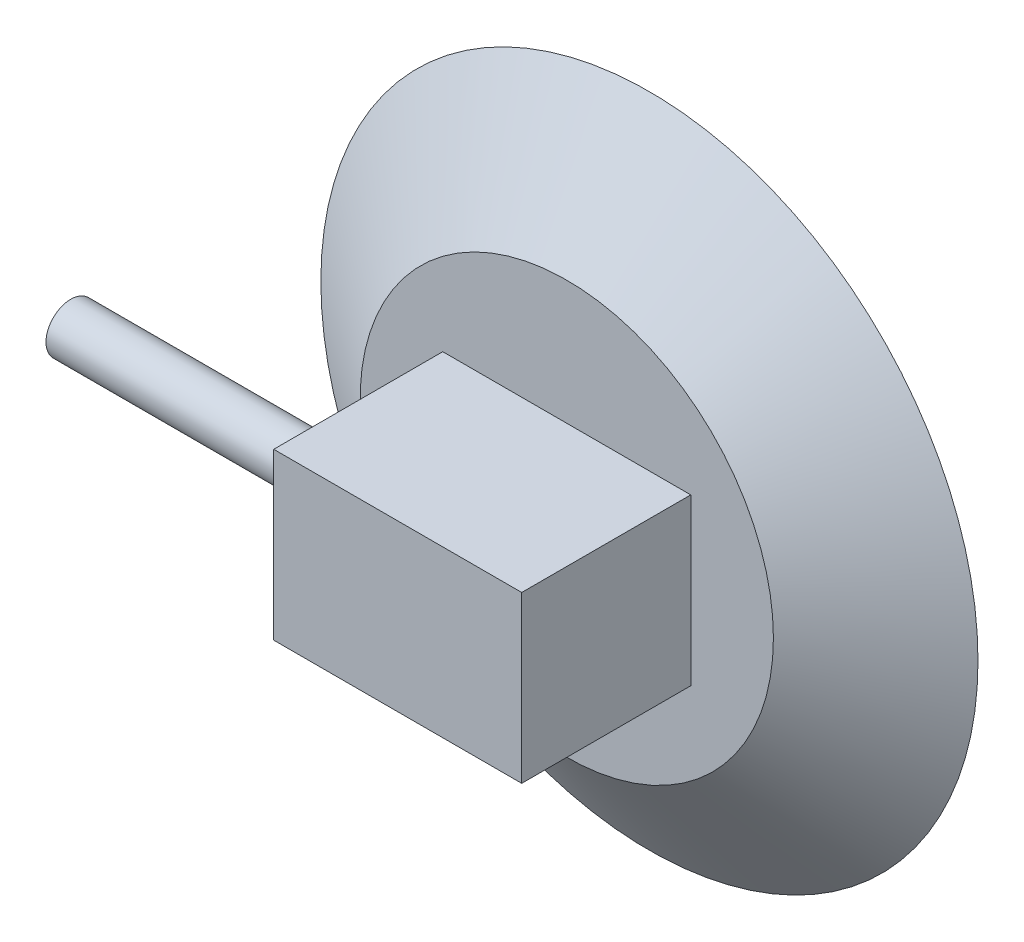
from build123d import *

# Parameters (mm, degrees)
SKETCH_2_R      = 79.5
SKETCH_3_R      = 50
SKETCH_4_W      = 60
SKETCH_4_H      = 40
EXTRUDE_1_DEPTH = 40.9
EXTRUDE_2_DEPTH = 10
SKETCH_6_R      = 6
EXTRUDE_3_DEPTH = 60


with BuildPart() as part:
    # 草图2 → 放样1 section 0
    with BuildSketch(Plane.XY):
        Circle(SKETCH_2_R)
    # 草图3 → 放样1 section 1
    with BuildSketch(Plane.XY.offset(20)):
        Circle(SKETCH_3_R)
    loft()

    # 草图4 → 凸台-拉伸1 (add)
    with BuildSketch(Plane.XY.offset(20)):
        Rectangle(SKETCH_4_W, SKETCH_4_H)
    extrude(amount=EXTRUDE_1_DEPTH)

    # 草图5 → 凸台-拉伸2 (add)
    with BuildSketch(Plane.ZY.offset(30)):
        with BuildLine():
            Line((20, 10), (40, 10))
            ThreePointArc((40, 10), (50, 0), (40, -10))
            Line((40, -10), (20, -10))
            Line((20, -10), (20, 10))
        make_face()
    extrude(amount=EXTRUDE_2_DEPTH)

    # 草图6 → 凸台-拉伸3 (add)
    with BuildSketch(Plane.ZY.offset(40)):
        with Locations((40, 0)):
            Circle(SKETCH_6_R)
    extrude(amount=EXTRUDE_3_DEPTH)


solid = part.part
